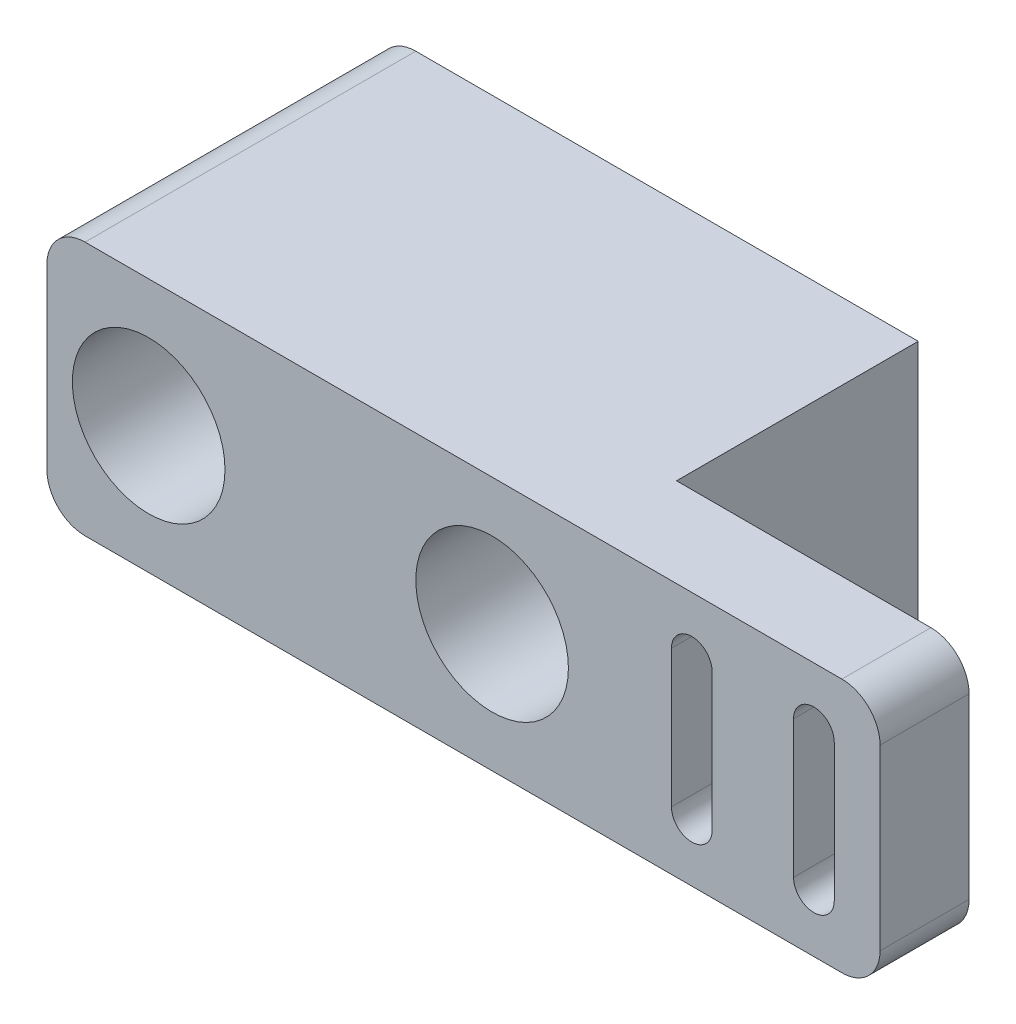
from build123d import *

# Parameters (mm, degrees)
SKETCH1_R           = 2.6
BOSS_EXTRUDE1_DEPTH = 7
BOSS_EXTRUDE2_DEPTH = 19
SKETCH3_R           = 2.6
CUT_EXTRUDE1_DEPTH  = 19
SKETCH4_R           = 6
CUT_EXTRUDE2_DEPTH  = 14


with BuildPart() as part:
    # Sketch1 → Boss-Extrude1 (new body)
    with BuildSketch(Plane.XY):
        with BuildLine():
            Line((3, 0), (62.5, 0))
            ThreePointArc((62.5, 0), (64.621320344, 0.878679656), (65.5, 3))
            Line((65.5, 3), (65.5, 17))
            ThreePointArc((65.5, 17), (64.621320344, 19.121320344), (62.5, 20))
            Line((62.5, 20), (3, 20))
            ThreePointArc((3, 20), (0.878679656, 19.121320344), (0, 17))
            Line((0, 17), (0, 3))
            ThreePointArc((0, 3), (0.878679656, 0.878679656), (3, 0))
        make_face()
        with Locations((8, 10)):
            Circle(SKETCH1_R, mode=Mode.SUBTRACT)
        with Locations((35, 10)):
            Circle(SKETCH1_R, mode=Mode.SUBTRACT)
        with BuildLine():
            Line((49.1, 15.4), (49.1, 4.6))
            ThreePointArc((49.1, 4.6), (50.7, 3), (52.3, 4.6))
            Line((52.3, 4.6), (52.3, 15.4))
            ThreePointArc((52.3, 15.4), (50.7, 17), (49.1, 15.4))
        make_face(mode=Mode.SUBTRACT)
        with BuildLine():
            Line((58.7, 15.4), (58.7, 4.6))
            ThreePointArc((58.7, 4.6), (60.3, 3), (61.9, 4.6))
            Line((61.9, 4.6), (61.9, 15.4))
            ThreePointArc((61.9, 15.4), (60.3, 17), (58.7, 15.4))
        make_face(mode=Mode.SUBTRACT)
    extrude(amount=-BOSS_EXTRUDE1_DEPTH)

    # Sketch2 → Boss-Extrude2 (add)
    with BuildSketch(Plane(origin=(0, 0, -7), x_dir=(-1, 0, 0), z_dir=(0, 0, -1))):
        with BuildLine():
            Line((-42.5, 20), (-42.5, 0))
            Line((-42.5, 0), (-3, 0))
            ThreePointArc((-3, 0), (-0.878679656, 0.878679656), (0, 3))
            Line((0, 3), (0, 17))
            ThreePointArc((0, 17), (-0.878679656, 19.121320344), (-3, 20))
            Line((-3, 20), (-42.5, 20))
        make_face()
    extrude(amount=BOSS_EXTRUDE2_DEPTH)

    # Sketch3 → Cut-Extrude1 (cut)
    with BuildSketch(Plane.XY.offset(-7)):
        with Locations((8, 10)):
            Circle(SKETCH3_R)
        with Locations((35, 10)):
            Circle(SKETCH3_R)
    extrude(amount=-CUT_EXTRUDE1_DEPTH, mode=Mode.SUBTRACT)

    # Sketch4 → Cut-Extrude2 (cut)
    with BuildSketch(Plane.XY):
        with Locations((8, 10)):
            Circle(SKETCH4_R)
        with Locations((35, 10)):
            Circle(SKETCH4_R)
    extrude(amount=-CUT_EXTRUDE2_DEPTH, mode=Mode.SUBTRACT)


solid = part.part
